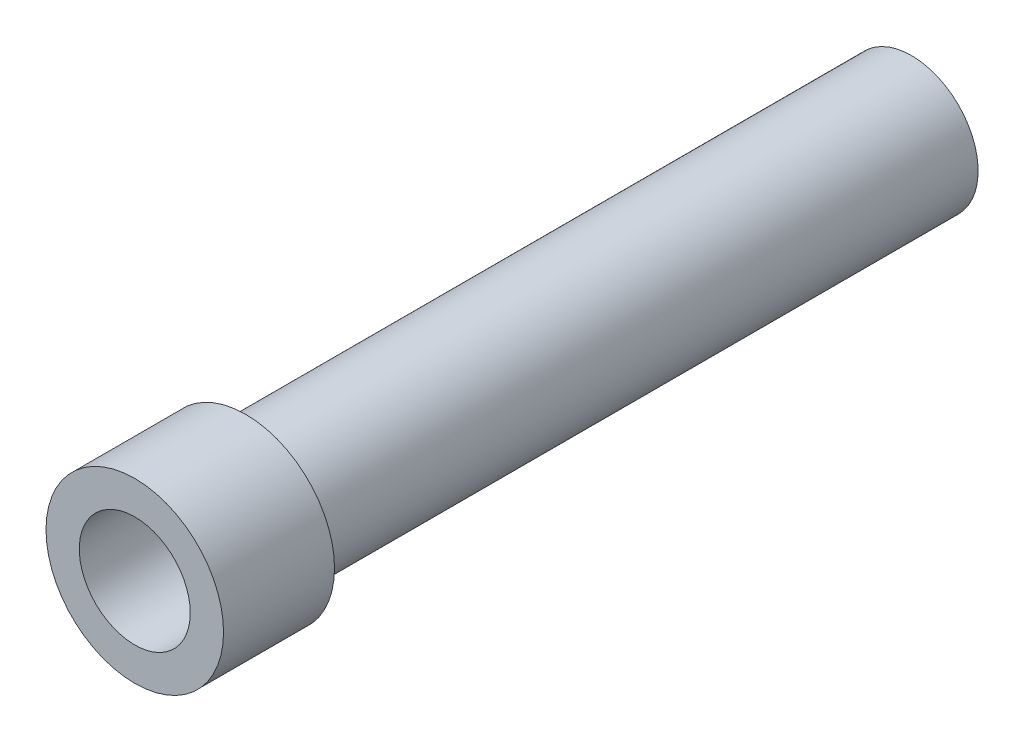
from build123d import *

# Parameters (mm, degrees)
SKIZZE1_R                       = 4
AUFSATZ_LINEAR_AUSTRAGEN1_DEPTH = 35
SKIZZE2_R                       = 2.5
SCHNITT_LINEAR_AUSTRAGEN1_DEPTH = 27
SKIZZE3_R                       = 12.769442974
SKIZZE3_R_2                     = 3
SCHNITT_LINEAR_AUSTRAGEN2_DEPTH = 30


with BuildPart() as part:
    # Skizze1 → Aufsatz-Linear austragen1 (new body)
    with BuildSketch(Plane.XY):
        with Locations((-21.202438913, 3.95852329)):
            Circle(SKIZZE1_R)
    extrude(amount=AUFSATZ_LINEAR_AUSTRAGEN1_DEPTH)

    # Skizze2 → Schnitt-Linear austragen1 (cut)
    with BuildSketch(Plane.XY.offset(35)):
        with Locations((-21.202438913, 3.95852329)):
            Circle(SKIZZE2_R)
    extrude(amount=-SCHNITT_LINEAR_AUSTRAGEN1_DEPTH, mode=Mode.SUBTRACT)

    # Skizze3 → Schnitt-Linear austragen2 (cut)
    with BuildSketch(Plane(origin=(0, 0, 0), x_dir=(-1, 0, 0), z_dir=(0, 0, -1))):
        with Locations((21.202438913, 3.95852329)):
            Circle(SKIZZE3_R)
        with Locations((21.202438913, 3.95852329)):
            Circle(SKIZZE3_R_2, mode=Mode.SUBTRACT)
    extrude(amount=-SCHNITT_LINEAR_AUSTRAGEN2_DEPTH, mode=Mode.SUBTRACT)


solid = part.part
